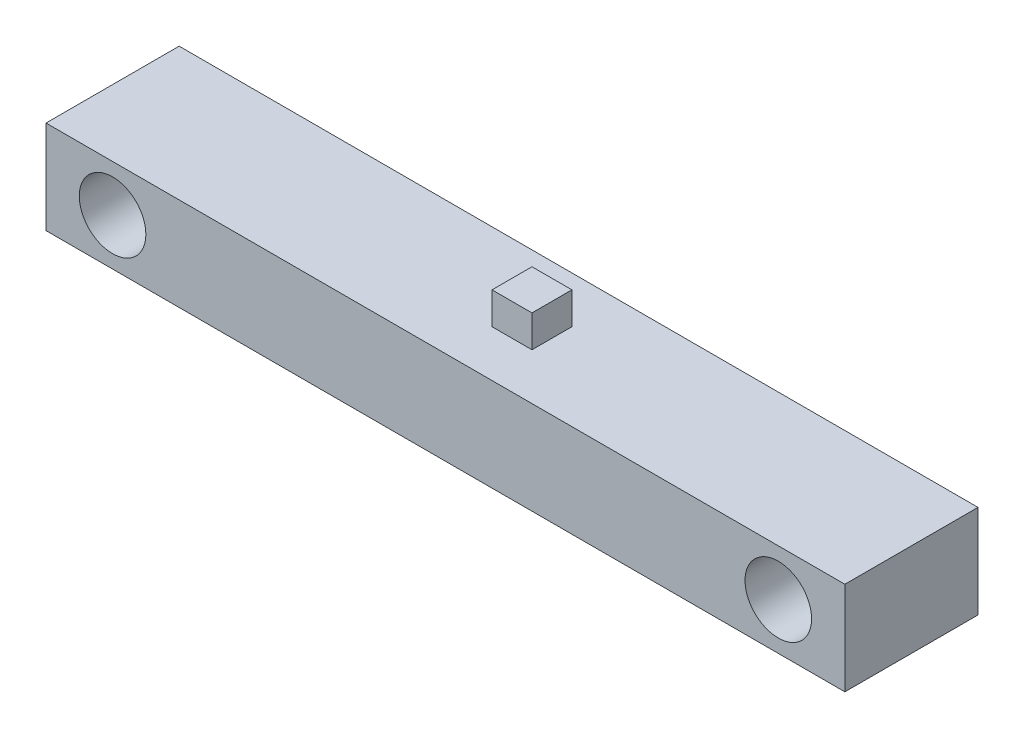
from build123d import *

# Parameters (mm, degrees)
SKETCH1_W           = 300
SKETCH1_H           = 50
BOSS_EXTRUDE1_DEPTH = 35
SKETCH2_W           = 15
SKETCH2_H           = 15
BOSS_EXTRUDE2_DEPTH = 12
CUT_EXTRUDE1_REACH  = 166.952
SKETCH3_R           = 12.5


with BuildPart() as part:
    # Sketch1 → Boss-Extrude1 (new body)
    with BuildSketch(Plane(origin=(0, 0, 0), x_dir=(1, 0, 0), z_dir=(0, 1, 0))):
        with Locations((0, 25)):
            Rectangle(SKETCH1_W, SKETCH1_H)
    extrude(amount=BOSS_EXTRUDE1_DEPTH)

    # Sketch2 → Boss-Extrude2 (add)
    with BuildSketch(Plane(origin=(0, 35, 0), x_dir=(1, 0, 0), z_dir=(0, 1, 0))):
        with Locations((7.5, 25)):
            Rectangle(SKETCH2_W, SKETCH2_H)
    extrude(amount=BOSS_EXTRUDE2_DEPTH)

    # Sketch3 → Cut-Extrude1 (cut, up to next)
    with BuildSketch(Plane.XY, mode=Mode.PRIVATE) as cut_extrude1_sk1:
        with Locations((-125, 17.5)):
            Circle(SKETCH3_R)
    cut_extrude1_tool1 = extrude(cut_extrude1_sk1.sketch, amount=-CUT_EXTRUDE1_REACH, mode=Mode.PRIVATE) & part.part
    # Sketch3 → Cut-Extrude1 (cut, up to next)
    with BuildSketch(Plane.XY, mode=Mode.PRIVATE) as cut_extrude1_sk2:
        with Locations((125, 17.5)):
            Circle(SKETCH3_R)
    cut_extrude1_tool2 = extrude(cut_extrude1_sk2.sketch, amount=-CUT_EXTRUDE1_REACH, mode=Mode.PRIVATE) & part.part
    add(cut_extrude1_tool1.solids().sort_by_distance((-125, 17.5, 0))[0], mode=Mode.SUBTRACT)
    add(cut_extrude1_tool2.solids().sort_by_distance((125, 17.5, 0))[0], mode=Mode.SUBTRACT)


solid = part.part
